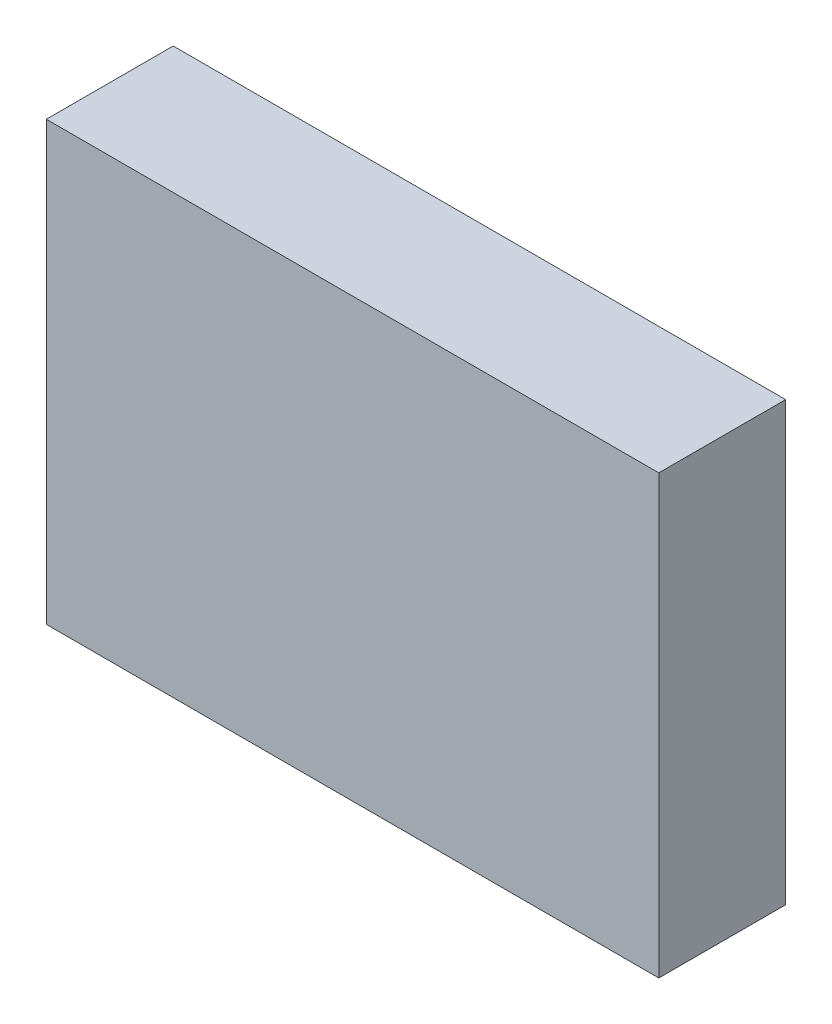
from build123d import *

# Parameters (mm, degrees)
SKETCH1_W           = 14
SKETCH1_H           = 10
BOSS_EXTRUDE1_DEPTH = 2.9


with BuildPart() as part:
    # Sketch1 → Boss-Extrude1 (new body)
    with BuildSketch(Plane.XY):
        with Locations((1.478873239, -2.885758998)):
            Rectangle(SKETCH1_W, SKETCH1_H)
    extrude(amount=BOSS_EXTRUDE1_DEPTH)


solid = part.part
